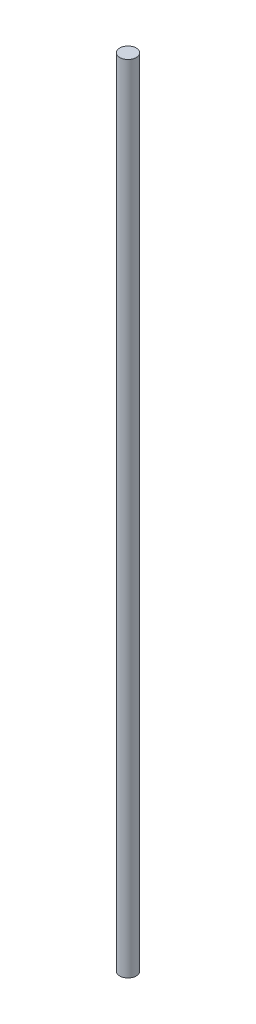
from build123d import *

# Parameters (mm, degrees)
SKETCH1_R           = 3.175
BOSS_EXTRUDE1_DEPTH = 305.562


with BuildPart() as part:
    # Sketch1 → Boss-Extrude1 (new body)
    with BuildSketch(Plane(origin=(0, 0, 0), x_dir=(1, 0, 0), z_dir=(0, 1, 0))):
        with Locations(Location((0, 0, 0), (0, 0, 270))):
            Circle(SKETCH1_R)
    extrude(amount=BOSS_EXTRUDE1_DEPTH)


solid = part.part
